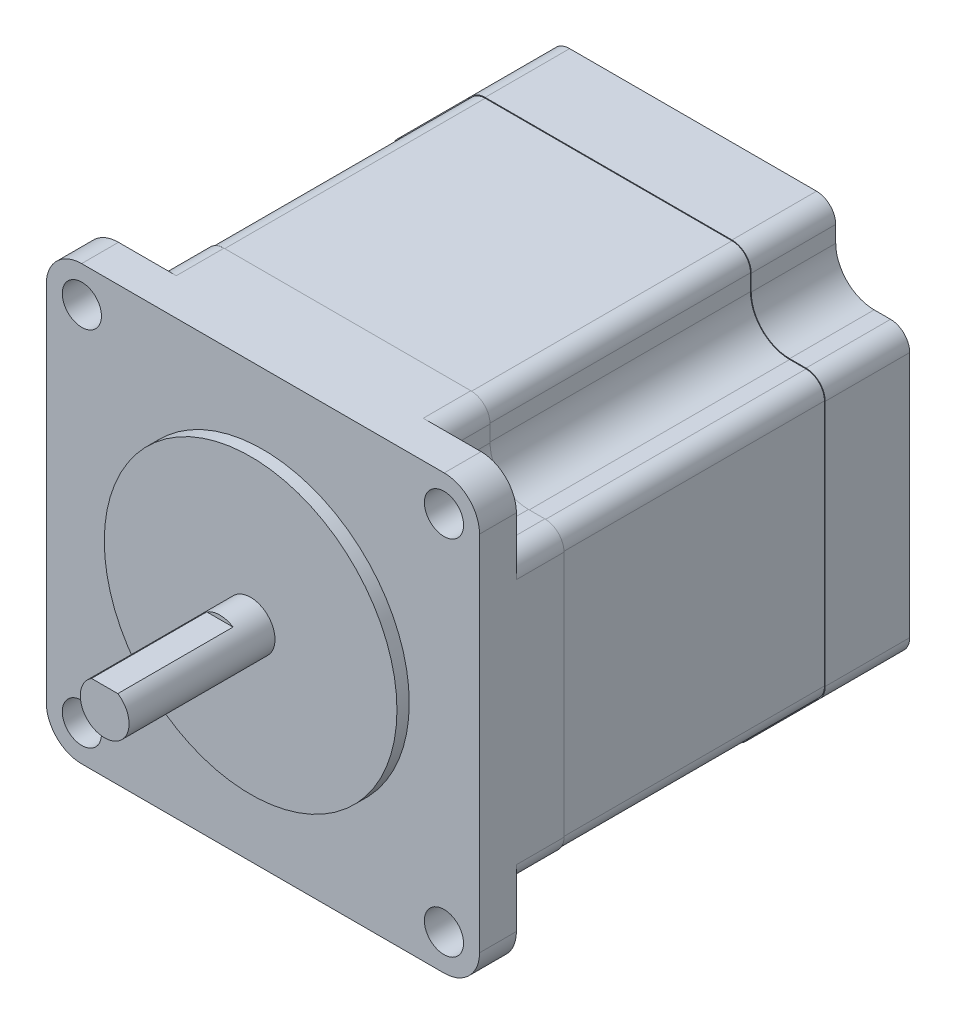
from build123d import *

# Parameters (mm, degrees)
SKETCH1_R           = 3.175
BOSS_EXTRUDE1_DEPTH = 20.6
SKETCH2_R           = 19.05
BOSS_EXTRUDE2_DEPTH = 1.6
BOSS_EXTRUDE3_DEPTH = 4.8
BOSS_EXTRUDE4_DEPTH = 51.2
SKETCH7_W           = 3.420526276
SKETCH7_H           = 1.112659396
CUT_EXTRUDE5_DEPTH  = 15
CUT_EXTRUDE6_REACH  = 70.749
SKETCH8_R           = 2.55
CUT_EXTRUDE7_DEPTH  = 17


with BuildPart() as part:
    # Sketch1 → Boss-Extrude1 (new body)
    with BuildSketch(Plane.XY):
        with Locations(Location((0, 0, 0), (0, 0, 180))):
            Circle(SKETCH1_R)
    extrude(amount=BOSS_EXTRUDE1_DEPTH)

    # Sketch2 → Boss-Extrude2 (add)
    with BuildSketch(Plane(origin=(0, 0, 0), x_dir=(-1, 0, 0), z_dir=(0, 0, -1))):
        Circle(SKETCH2_R)
    extrude(amount=-BOSS_EXTRUDE2_DEPTH)

    # Sketch3 → Boss-Extrude3 (add)
    with BuildSketch(Plane(origin=(0, 0, 0), x_dir=(-1, 0, 0), z_dir=(0, 0, -1))):
        with BuildLine():
            Line((23.6, -28.2), (-23.6, -28.2))
            ThreePointArc((-23.6, -28.2), (-26.852691193, -26.852691193), (-28.2, -23.6))
            Line((-28.2, -23.6), (-28.2, 23.6))
            ThreePointArc((-28.2, 23.6), (-26.852691193, 26.852691193), (-23.6, 28.2))
            Line((-23.6, 28.2), (23.6, 28.2))
            ThreePointArc((23.6, 28.2), (26.852691193, 26.852691193), (28.2, 23.6))
            Line((28.2, 23.6), (28.2, -23.6))
            ThreePointArc((28.2, -23.6), (26.852691193, -26.852691193), (23.6, -28.2))
        make_face()
    extrude(amount=BOSS_EXTRUDE3_DEPTH)

    # Sketch4 → Boss-Extrude4 (add)
    with BuildSketch(Plane(origin=(0, 0, -4.8), x_dir=(-1, 0, 0), z_dir=(0, 0, -1))):
        with BuildLine():
            Line((-18.57, 23.57), (-18.57, 25.7))
            ThreePointArc((-18.57, 25.7), (-17.837766953, 27.467766953), (-16.07, 28.2))
            Line((-16.07, 28.2), (16.07, 28.2))
            ThreePointArc((16.07, 28.2), (17.837766953, 27.467766953), (18.57, 25.7))
            Line((18.57, 25.7), (18.57, 23.57))
            ThreePointArc((18.57, 23.57), (20.034466094, 20.034466094), (23.57, 18.57))
            Line((23.57, 18.57), (25.7, 18.57))
            ThreePointArc((25.7, 18.57), (27.467766953, 17.837766953), (28.2, 16.07))
            Line((28.2, 16.07), (28.2, -16.07))
            ThreePointArc((28.2, -16.07), (27.467766953, -17.837766953), (25.7, -18.57))
            Line((25.7, -18.57), (23.57, -18.57))
            ThreePointArc((23.57, -18.57), (20.034466094, -20.034466094), (18.57, -23.57))
            Line((18.57, -23.57), (18.57, -25.7))
            ThreePointArc((18.57, -25.7), (17.837766953, -27.467766953), (16.07, -28.2))
            Line((16.07, -28.2), (-16.07, -28.2))
            ThreePointArc((-16.07, -28.2), (-17.837766953, -27.467766953), (-18.57, -25.7))
            Line((-18.57, -25.7), (-18.57, -23.57))
            ThreePointArc((-18.57, -23.57), (-20.034466094, -20.034466094), (-23.57, -18.57))
            Line((-23.57, -18.57), (-25.7, -18.57))
            ThreePointArc((-25.7, -18.57), (-27.467766953, -17.837766953), (-28.2, -16.07))
            Line((-28.2, -16.07), (-28.2, 16.07))
            ThreePointArc((-28.2, 16.07), (-27.467766953, 17.837766953), (-25.7, 18.57))
            Line((-25.7, 18.57), (-23.57, 18.57))
            ThreePointArc((-23.57, 18.57), (-20.034466094, 20.034466094), (-18.57, 23.57))
        make_face()
    extrude(amount=BOSS_EXTRUDE4_DEPTH)

    # Sketch7 → Cut-Extrude5 (cut)
    with BuildSketch(Plane.XY.offset(20.6)):
        with Locations((0, 3.231329698)):
            Rectangle(SKETCH7_W, SKETCH7_H)
    extrude(amount=-CUT_EXTRUDE5_DEPTH, mode=Mode.SUBTRACT)

    # Sketch8 → Cut-Extrude6 (cut, up to next)
    with BuildSketch(Plane.XY, mode=Mode.PRIVATE) as cut_extrude6_sk1:
        with Locations((-23.57, 23.57)):
            Circle(SKETCH8_R)
    cut_extrude6_tool1 = extrude(cut_extrude6_sk1.sketch, amount=-CUT_EXTRUDE6_REACH, mode=Mode.PRIVATE) & part.part
    # Sketch8 → Cut-Extrude6 (cut, up to next)
    with BuildSketch(Plane.XY, mode=Mode.PRIVATE) as cut_extrude6_sk2:
        with Locations((23.57, 23.57)):
            Circle(SKETCH8_R)
    cut_extrude6_tool2 = extrude(cut_extrude6_sk2.sketch, amount=-CUT_EXTRUDE6_REACH, mode=Mode.PRIVATE) & part.part
    # Sketch8 → Cut-Extrude6 (cut, up to next)
    with BuildSketch(Plane.XY, mode=Mode.PRIVATE) as cut_extrude6_sk3:
        with Locations((23.57, -23.57)):
            Circle(SKETCH8_R)
    cut_extrude6_tool3 = extrude(cut_extrude6_sk3.sketch, amount=-CUT_EXTRUDE6_REACH, mode=Mode.PRIVATE) & part.part
    # Sketch8 → Cut-Extrude6 (cut, up to next)
    with BuildSketch(Plane.XY, mode=Mode.PRIVATE) as cut_extrude6_sk4:
        with Locations((-23.57, -23.57)):
            Circle(SKETCH8_R)
    cut_extrude6_tool4 = extrude(cut_extrude6_sk4.sketch, amount=-CUT_EXTRUDE6_REACH, mode=Mode.PRIVATE) & part.part
    add(cut_extrude6_tool1.solids().sort_by_distance((-23.57, 23.57, 0))[0], mode=Mode.SUBTRACT)
    add(cut_extrude6_tool2.solids().sort_by_distance((23.57, 23.57, 0))[0], mode=Mode.SUBTRACT)
    add(cut_extrude6_tool3.solids().sort_by_distance((23.57, -23.57, 0))[0], mode=Mode.SUBTRACT)
    add(cut_extrude6_tool4.solids().sort_by_distance((-23.57, -23.57, 0))[0], mode=Mode.SUBTRACT)

    # Sketch9 → Cut-Extrude7 (cut, symmetric)
    with BuildSketch(Plane.XY.offset(-28)):
        with BuildLine():
            Line((18.57, 23.57), (18.57, 25.7))
            ThreePointArc((18.57, 25.7), (17.837766953, 27.467766953), (16.07, 28.2))
            Line((16.07, 28.2), (-16.07, 28.2))
            ThreePointArc((-16.07, 28.2), (-17.837766953, 27.467766953), (-18.57, 25.7))
            Line((-18.57, 25.7), (-18.57, 23.57))
            ThreePointArc((-18.57, 23.57), (-20.034466094, 20.034466094), (-23.57, 18.57))
            Line((-23.57, 18.57), (-25.7, 18.57))
            ThreePointArc((-25.7, 18.57), (-27.467766953, 17.837766953), (-28.2, 16.07))
            Line((-28.2, 16.07), (-28.2, -16.07))
            ThreePointArc((-28.2, -16.07), (-27.467766953, -17.837766953), (-25.7, -18.57))
            Line((-25.7, -18.57), (-23.57, -18.57))
            ThreePointArc((-23.57, -18.57), (-20.034466094, -20.034466094), (-18.57, -23.57))
            Line((-18.57, -23.57), (-18.57, -25.7))
            ThreePointArc((-18.57, -25.7), (-17.837766953, -27.467766953), (-16.07, -28.2))
            Line((-16.07, -28.2), (16.07, -28.2))
            ThreePointArc((16.07, -28.2), (17.837766953, -27.467766953), (18.57, -25.7))
            Line((18.57, -25.7), (18.57, -23.57))
            ThreePointArc((18.57, -23.57), (20.034466094, -20.034466094), (23.57, -18.57))
            Line((23.57, -18.57), (25.7, -18.57))
            ThreePointArc((25.7, -18.57), (27.467766953, -17.837766953), (28.2, -16.07))
            Line((28.2, -16.07), (28.2, 16.07))
            ThreePointArc((28.2, 16.07), (27.467766953, 17.837766953), (25.7, 18.57))
            Line((25.7, 18.57), (23.57, 18.57))
            ThreePointArc((23.57, 18.57), (20.034466094, 20.034466094), (18.57, 23.57))
        make_face()
        with BuildLine():
            Line((18.47, 23.57), (18.47, 25.7))
            ThreePointArc((18.47, 25.7), (17.767056275, 27.397056275), (16.07, 28.1))
            Line((16.07, 28.1), (-16.07, 28.1))
            ThreePointArc((-16.07, 28.1), (-17.767056275, 27.397056275), (-18.47, 25.7))
            Line((-18.47, 25.7), (-18.47, 23.57))
            ThreePointArc((-18.47, 23.57), (-19.963755416, 19.963755416), (-23.57, 18.47))
            Line((-23.57, 18.47), (-25.7, 18.47))
            ThreePointArc((-25.7, 18.47), (-27.397056275, 17.767056275), (-28.1, 16.07))
            Line((-28.1, 16.07), (-28.1, -16.07))
            ThreePointArc((-28.1, -16.07), (-27.397056275, -17.767056275), (-25.7, -18.47))
            Line((-25.7, -18.47), (-23.57, -18.47))
            ThreePointArc((-23.57, -18.47), (-19.963755416, -19.963755416), (-18.47, -23.57))
            Line((-18.47, -23.57), (-18.47, -25.7))
            ThreePointArc((-18.47, -25.7), (-17.767056275, -27.397056275), (-16.07, -28.1))
            Line((-16.07, -28.1), (16.07, -28.1))
            ThreePointArc((16.07, -28.1), (17.767056275, -27.397056275), (18.47, -25.7))
            Line((18.47, -25.7), (18.47, -23.57))
            ThreePointArc((18.47, -23.57), (19.963755416, -19.963755416), (23.57, -18.47))
            Line((23.57, -18.47), (25.7, -18.47))
            ThreePointArc((25.7, -18.47), (27.397056275, -17.767056275), (28.1, -16.07))
            Line((28.1, -16.07), (28.1, 16.07))
            ThreePointArc((28.1, 16.07), (27.397056275, 17.767056275), (25.7, 18.47))
            Line((25.7, 18.47), (23.57, 18.47))
            ThreePointArc((23.57, 18.47), (19.963755416, 19.963755416), (18.47, 23.57))
        make_face(mode=Mode.SUBTRACT)
    extrude(amount=CUT_EXTRUDE7_DEPTH, both=True, mode=Mode.SUBTRACT)


solid = part.part
